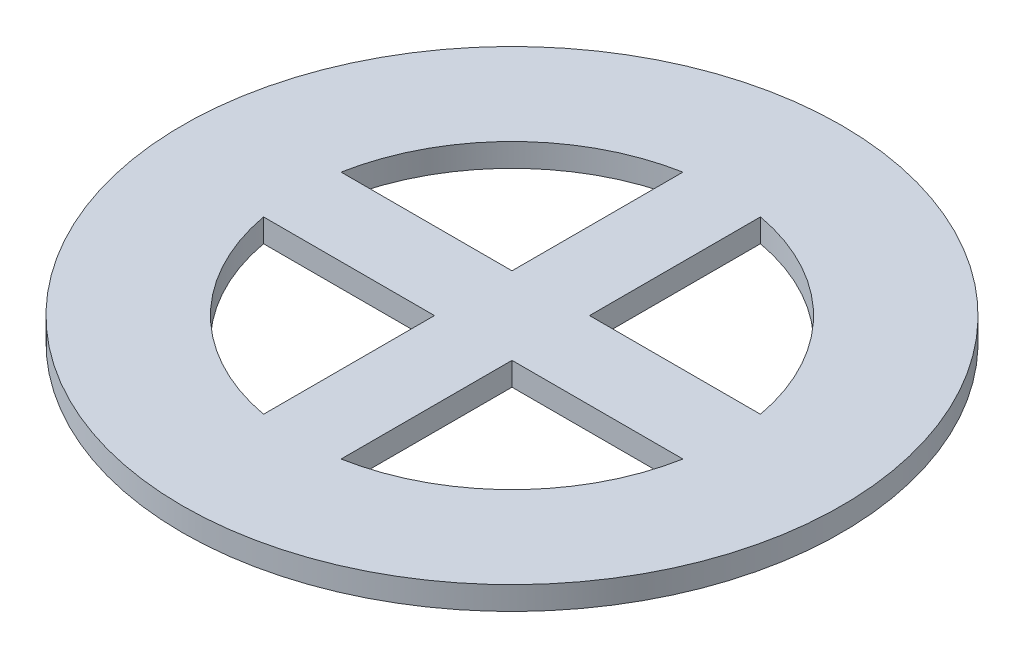
from build123d import *

# Parameters (mm, degrees)
ESBO_O1_R                = 85
RESSALTO_EXTRUS_O1_DEPTH = 6


with BuildPart() as part:
    # Esboço1 → Ressalto-extrusão1 (new body)
    with BuildSketch(Plane(origin=(0, 0, 0), x_dir=(1, 0, 0), z_dir=(0, 1, 0))):
        with Locations(Location((0, 0, 0), (0, 0, 270))):
            Circle(ESBO_O1_R)
        with BuildLine():
            Line((-54.083269132, -10), (-10, -10))
            Line((-10, -10), (-10, -54.083269132))
            ThreePointArc((-10, -54.083269132), (-38.890872965, -38.890872965), (-54.083269132, -10))
        make_face(mode=Mode.SUBTRACT)
        with BuildLine():
            Line((10, -54.083269132), (10, -10))
            Line((10, -10), (54.083269132, -10))
            ThreePointArc((54.083269132, -10), (38.890872965, -38.890872965), (10, -54.083269132))
        make_face(mode=Mode.SUBTRACT)
        with BuildLine():
            Line((54.083269132, 10), (10, 10))
            Line((10, 10), (10, 54.083269132))
            ThreePointArc((10, 54.083269132), (38.890872965, 38.890872965), (54.083269132, 10))
        make_face(mode=Mode.SUBTRACT)
        with BuildLine():
            Line((-10, 54.083269132), (-10, 10))
            Line((-10, 10), (-54.083269132, 10))
            ThreePointArc((-54.083269132, 10), (-38.890872965, 38.890872965), (-10, 54.083269132))
        make_face(mode=Mode.SUBTRACT)
    extrude(amount=RESSALTO_EXTRUS_O1_DEPTH)


solid = part.part
